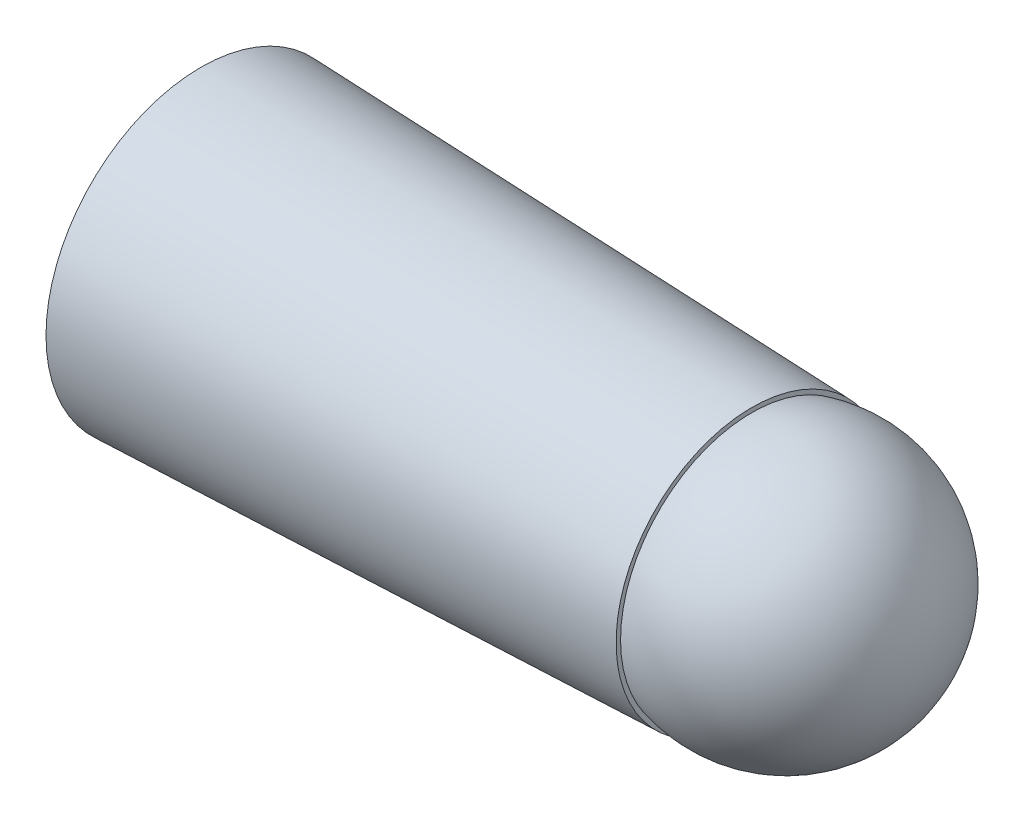
from build123d import *

# Parameters (mm, degrees)
SKETCH1_R           = 2.25
BOSS_EXTRUDE1_DEPTH = 8
BOSS_EXTRUDE1_TAPER = 2


with BuildPart() as part:
    # Sketch1 → Boss-Extrude1 (new body)
    with BuildSketch(Plane(origin=(0, 0, 0), x_dir=(0, 0, -1), z_dir=(1, 0, 0))):
        Circle(SKETCH1_R)
    extrude(amount=BOSS_EXTRUDE1_DEPTH, taper=BOSS_EXTRUDE1_TAPER)

    # Sketch2 → Revolve1 (revolve)
    with BuildSketch(Plane(origin=(8.5, 0, 0), x_dir=(0, 0, -1), z_dir=(1, 0, 0))):
        with BuildLine():
            Line((0, 1.970633844), (0, -1.970633844))
            ThreePointArc((0, -1.970633844), (1.970633844, 0), (0, 1.970633844))
        make_face()
    revolve(axis=Axis((8.5, 1.970633844, 0), (0, -1, 0)))


solid = part.part
